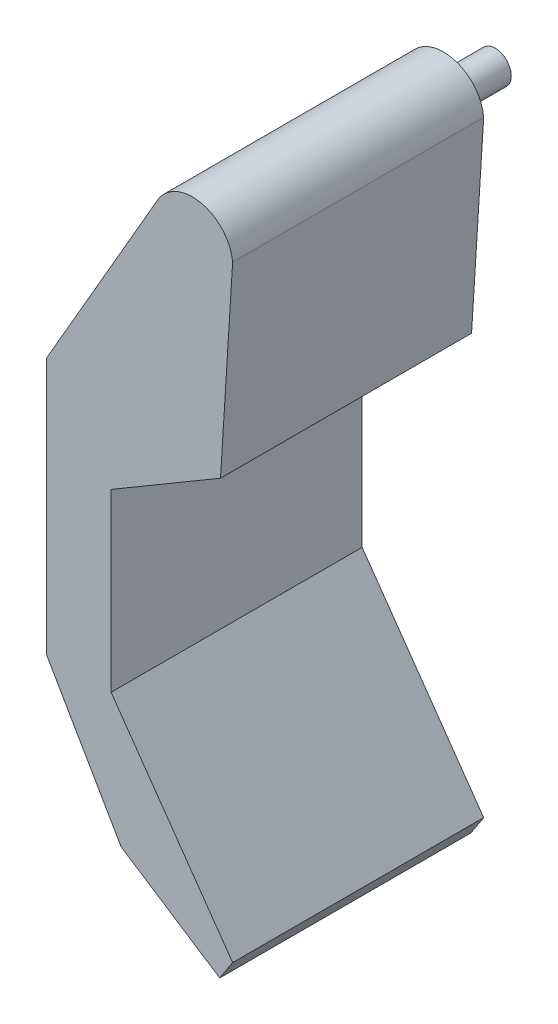
from build123d import *

# Parameters (mm, degrees)
EXTRUDE_4_DEPTH = 39
SKETCH_2_R      = 2.5
EXTRUDE_5_DEPTH = 8


with BuildPart() as part:
    # 草图1 → 凸台-拉伸4 (new body)
    with BuildSketch(Plane.XY):
        with BuildLine():
            ThreePointArc((11.999755772, 64.190702015), (7.19287537, 69.699227744), (0.441332655, 66.894477154))
            Line((0.441332655, 66.894477154), (-16.87917542, 36.894477154))
            Line((-16.87917542, 36.894477154), (-16.87917542, -3.105522846))
            Line((-16.87917542, -3.105522846), (-5.332170037, -23.105522846))
            Line((-5.332170037, -23.105522846), (9.992741519, -33.105522846))
            Line((9.992741519, -33.105522846), (11.999755772, -30.029791253))
            Line((11.999755772, -30.029791253), (-6.87917542, -3.105522846))
            Line((-6.87917542, -3.105522846), (-6.87917542, 14.190702015))
            Line((-6.87917542, 14.190702015), (-6.87917542, 24.190702015))
            Line((-6.87917542, 24.190702015), (10.114332844, 34.190702015))
            Line((10.114332844, 34.190702015), (11.999755772, 64.190702015))
        make_face()
    extrude(amount=EXTRUDE_4_DEPTH)

    # 草图2 → 凸台-拉伸5 (add)
    with BuildSketch(Plane.XY):
        with Locations((5.784422652, 63.881230161)):
            Circle(SKETCH_2_R)
    extrude(amount=-EXTRUDE_5_DEPTH)


solid = part.part
